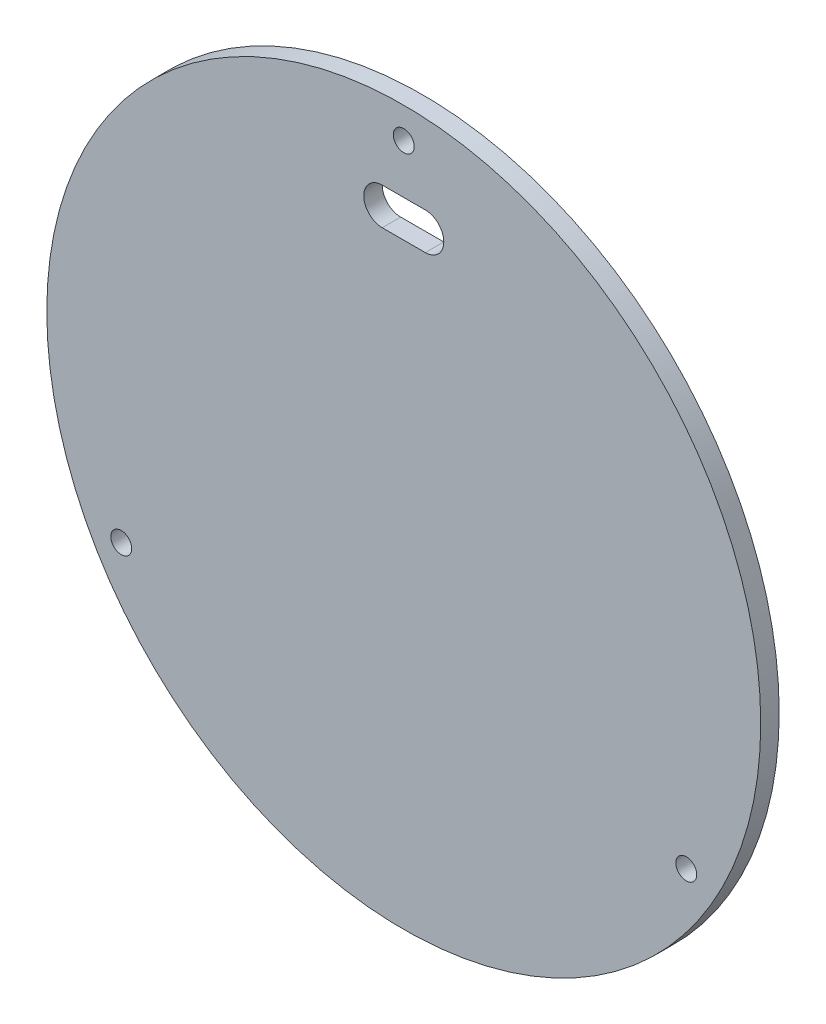
from build123d import *

# Parameters (mm, degrees)
SKETCH1_R           = 58
SKETCH1_R_2         = 1.7
BOSS_EXTRUDE1_DEPTH = 3
CUT_EXTRUDE1_DEPTH  = 83.079230016


with BuildPart() as part:
    # Sketch1 → Boss-Extrude1 (new body)
    with BuildSketch(Plane.XY):
        Circle(SKETCH1_R)
        with Locations((0, 53)):
            Circle(SKETCH1_R_2, mode=Mode.SUBTRACT)
        with Locations((45.899346401, -26.5)):
            Circle(SKETCH1_R_2, mode=Mode.SUBTRACT)
        with Locations((-45.899346401, -26.5)):
            Circle(SKETCH1_R_2, mode=Mode.SUBTRACT)
    extrude(amount=BOSS_EXTRUDE1_DEPTH)

    # Sketch2 → Cut-Extrude1 (cut, through all)
    with BuildSketch(Plane.XY.offset(3)):
        with BuildLine():
            Line((3.5, 45), (-3.5, 45))
            ThreePointArc((-3.5, 45), (-6.5, 42), (-3.5, 39))
            Line((-3.5, 39), (3.5, 39))
            ThreePointArc((3.5, 39), (6.5, 42), (3.5, 45))
        make_face()
    extrude(amount=-CUT_EXTRUDE1_DEPTH, mode=Mode.SUBTRACT)


solid = part.part
